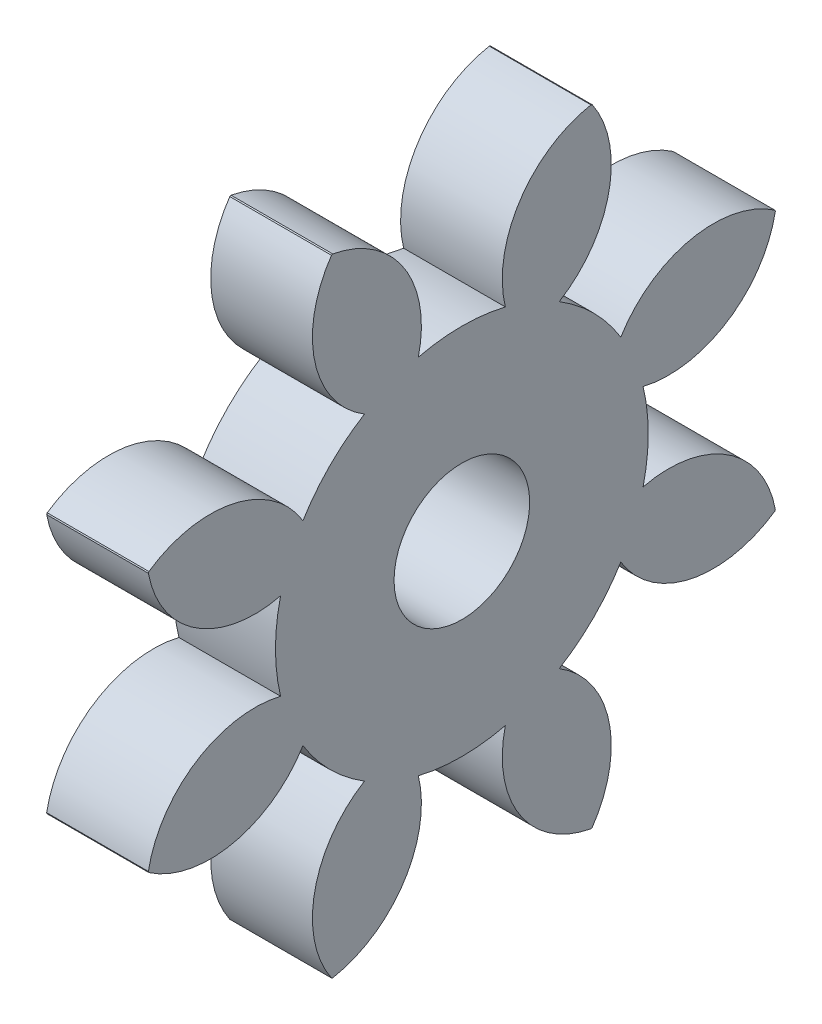
from build123d import *

# Parameters (mm, degrees)
BASPROSKE_W     = 1.5
BASPROSKE_H     = 5
TOOTHCUT_DEPTH  = 8.228416147
TEETHCUTS_COUNT = 8
TEETHCUTS_ANGLE = 315
BORSKE_R        = 1
BORE_DEPTH      = 50.0000508


with BuildPart() as part:
    # BasProSke → Base-Revolve (revolve)
    with BuildSketch(Plane(origin=(0, 0, 0), x_dir=(1, 0, 0), z_dir=(0, 1, 0)), mode=Mode.PRIVATE) as base_revolve_sk:
        with Locations((0.75, 2.5)):
            Rectangle(BASPROSKE_W, BASPROSKE_H)
    revolve(base_revolve_sk.sketch.rotate(Axis((-10, 0, 0), (1, 0, 0)), 180), axis=Axis((-10, 0, 0), (1, 0, 0)))

    # TooCutSke → ToothCut (cut, through all)
    with BuildSketch(Plane(origin=(0, 0, 0), x_dir=(0, 0, -1), z_dir=(1, 0, 0))):
        with BuildLine():
            ThreePointArc((0.641511531, 2.673100065), (0, 2.749), (-0.641511531, 2.673100065))
            ThreePointArc((-0.641511531, 2.673100065), (-0.866351647, 3.939589487), (-1.950827865, 4.631297421))
            ThreePointArc((-1.950827865, 4.631297421), (0, 5.0254), (1.950827865, 4.631297421))
            ThreePointArc((1.950827865, 4.631297421), (0.866351647, 3.939589487), (0.641511531, 2.673100065))
        make_face()
    toothcut = extrude(amount=TOOTHCUT_DEPTH, mode=Mode.SUBTRACT)

    # TeethCuts: ToothCut ×8 about axis
    teethcuts_axis = Axis((-10, 0, 0), (1, 0, 0))
    for i in range(1, TEETHCUTS_COUNT):
        add(toothcut.rotate(teethcuts_axis, i * TEETHCUTS_ANGLE / (TEETHCUTS_COUNT - 1)), mode=Mode.SUBTRACT)

    # BorSke → Bore (cut, symmetric)
    with BuildSketch(Plane(origin=(0, 0, 0), x_dir=(0, 0, -1), z_dir=(1, 0, 0))):
        with Locations(Location((0, 0, 0), (0, 0, 180))):
            Circle(BORSKE_R)
    extrude(amount=BORE_DEPTH, both=True, mode=Mode.SUBTRACT)


solid = part.part
